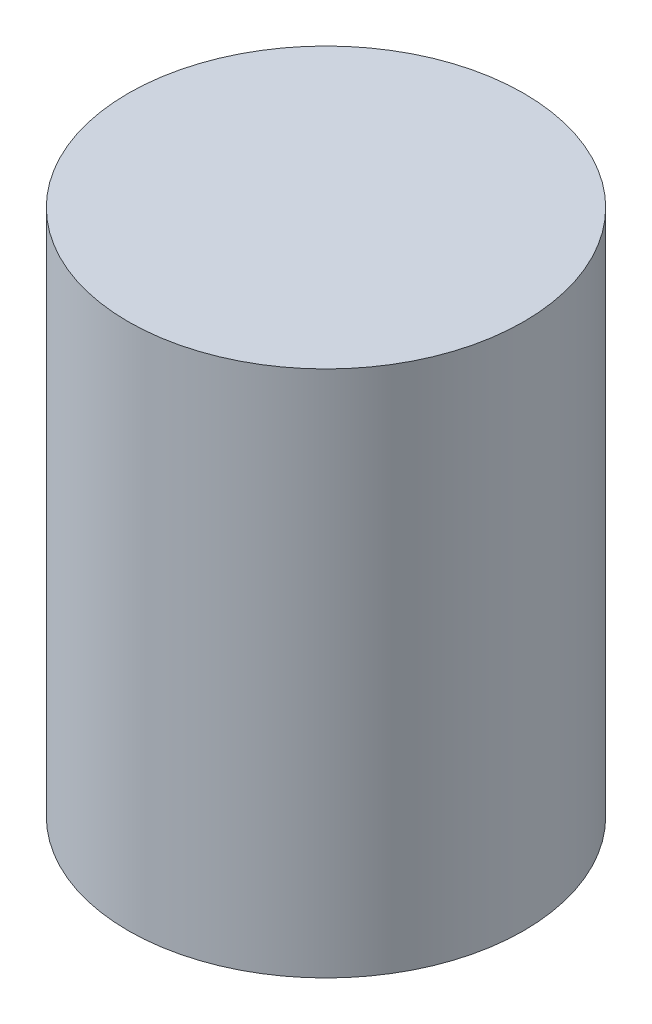
from build123d import *

# Parameters (mm, degrees)
SKETCH1_R           = 38.1
BOSS_EXTRUDE1_DEPTH = 50.8


with BuildPart() as part:
    # Sketch1 → Boss-Extrude1 (new, symmetric)
    with BuildSketch(Plane(origin=(0, 0, 0), x_dir=(1, 0, 0), z_dir=(0, 1, 0))):
        with Locations(Location((0, 0, 0), (0, 0, 270))):
            Circle(SKETCH1_R)
    extrude(amount=BOSS_EXTRUDE1_DEPTH, both=True)


solid = part.part
